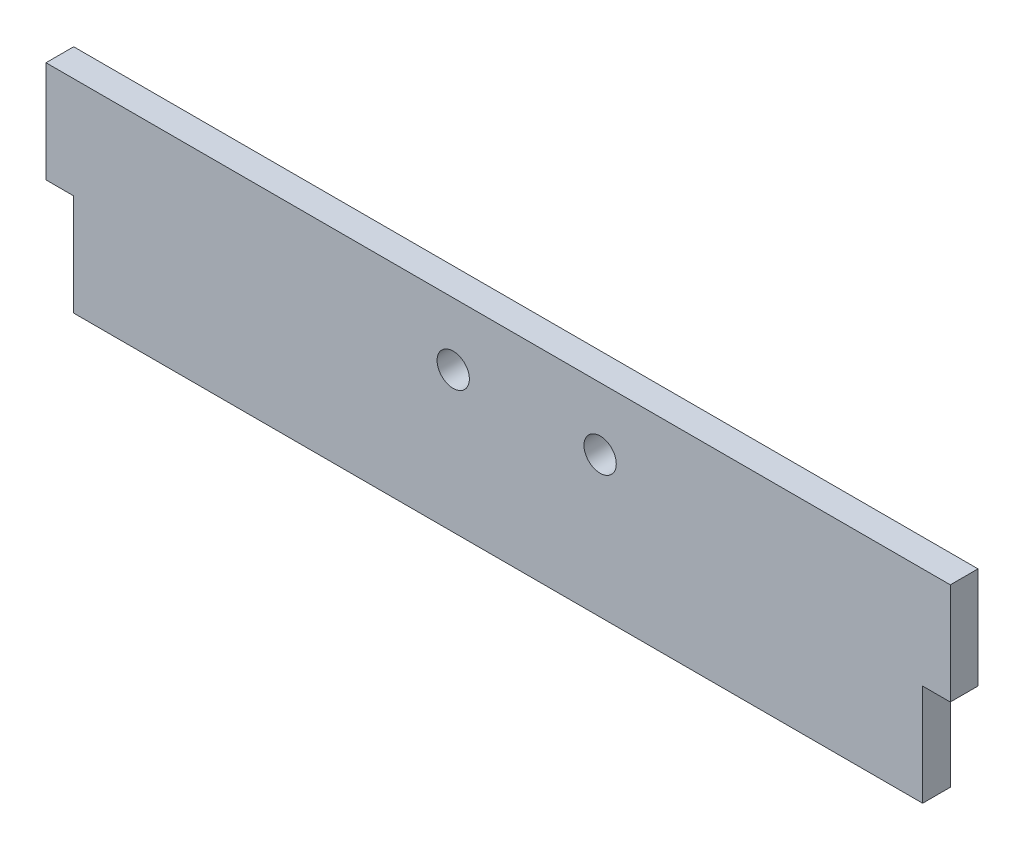
from build123d import *

# Parameters (mm, degrees)
SALIENTE_EXTRUIR1_DEPTH = 3
CROQUIS2_R              = 1.75
CORTAR_EXTRUIR1_DEPTH   = 3


with BuildPart() as part:
    # Croquis1 → Saliente-Extruir1 (new body)
    with BuildSketch(Plane.XY):
        Polygon((-46, 0), (46, 0), (46, 11), (49, 11), (49, 22), (-49, 22), (-49, 11), (-46, 11), align=None)
    extrude(amount=SALIENTE_EXTRUIR1_DEPTH)

    # Croquis2 → Cortar-Extruir1 (cut)
    with BuildSketch(Plane.XY.offset(3)):
        with Locations((-4.870305864, 15.24946205)):
            Circle(CROQUIS2_R)
        with Locations((11.05084095, 15.24946205)):
            Circle(CROQUIS2_R)
    extrude(amount=-CORTAR_EXTRUIR1_DEPTH, mode=Mode.SUBTRACT)


solid = part.part
